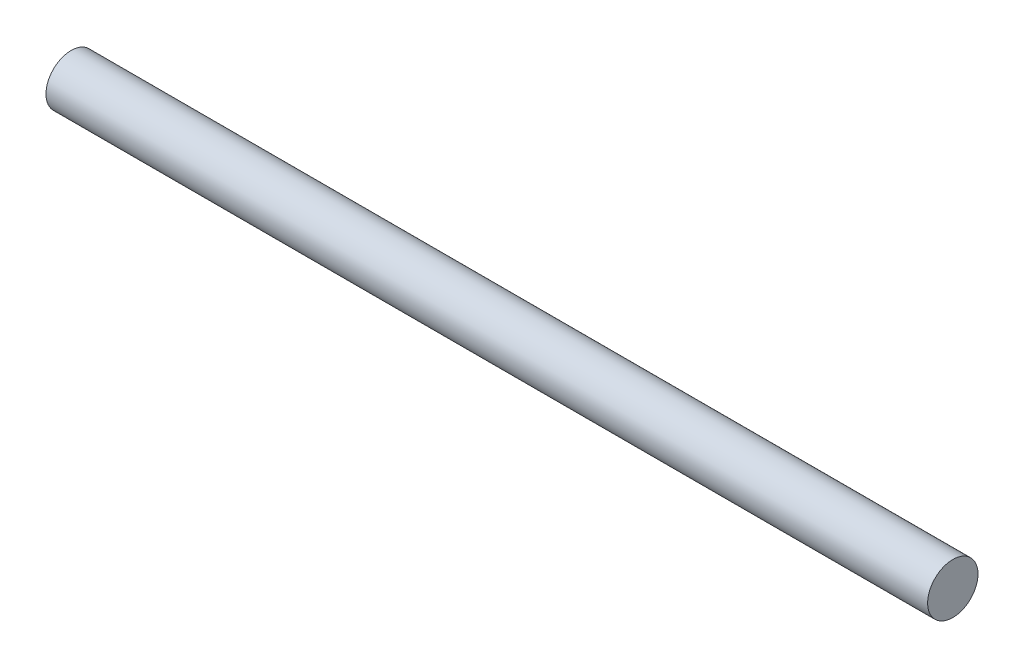
from build123d import *

# Parameters (mm, degrees)
SKETCH1_W = 70
SKETCH1_H = 2


with BuildPart() as part:
    # Sketch1 → Revolve1 (revolve)
    with BuildSketch(Plane.XY, mode=Mode.PRIVATE) as revolve1_sk:
        with Locations((35, 1)):
            Rectangle(SKETCH1_W, SKETCH1_H)
    revolve(revolve1_sk.sketch.rotate(Axis((70, 0, 0), (-1, 0, 0)), 90), axis=Axis((70, 0, 0), (-1, 0, 0)))


solid = part.part
